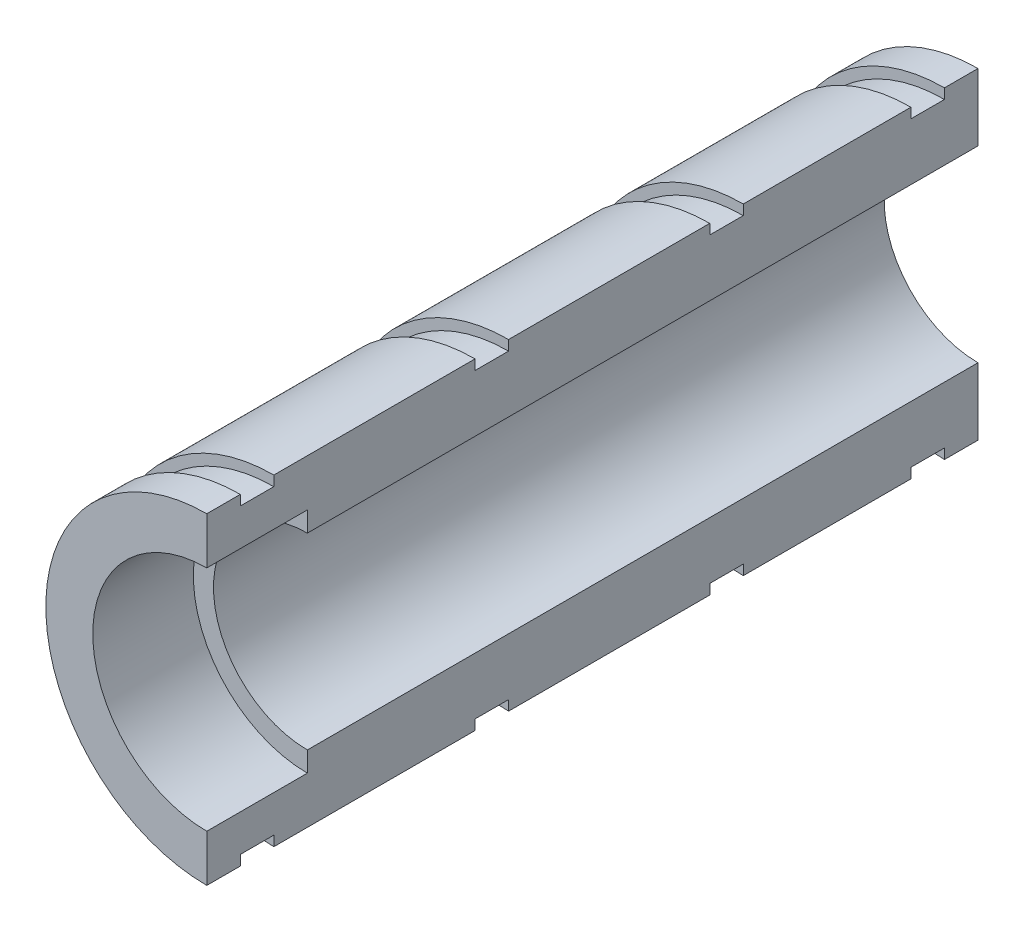
from build123d import *

# Parameters (mm, degrees)
SKETCH1_R           = 24
SKETCH1_R_2         = 14
BOSS_EXTRUDE1_DEPTH = 115
SKETCH2_W           = 30.560484556
SKETCH2_H           = 55.665733052
CUT_EXTRUDE1_DEPTH  = 130
SKETCH3_R           = 17
CUT_EXTRUDE2_DEPTH  = 15
SKETCH4_R           = 29.348690421
SKETCH4_R_2         = 22.5
CUT_EXTRUDE3_DEPTH  = 5
SKETCH5_R           = 32.227537674
SKETCH5_R_2         = 22.5
CUT_EXTRUDE4_DEPTH  = 5
SKETCH6_R           = 32.40953394
SKETCH6_R_2         = 22.5
CUT_EXTRUDE5_DEPTH  = 5
CUT_EXTRUDE6_START  = 5
SKETCH7_R           = 39.356381894
SKETCH7_R_2         = 22.5
CUT_EXTRUDE6_DEPTH  = 5


with BuildPart() as part:
    # Sketch1 → Boss-Extrude1 (new body)
    with BuildSketch(Plane.XY):
        Circle(SKETCH1_R)
        Circle(SKETCH1_R_2, mode=Mode.SUBTRACT)
    extrude(amount=BOSS_EXTRUDE1_DEPTH)

    # Sketch2 → Cut-Extrude1 (cut)
    with BuildSketch(Plane.XY.offset(115)):
        with Locations((15.280242278, -0.503267732)):
            Rectangle(SKETCH2_W, SKETCH2_H)
    extrude(amount=-CUT_EXTRUDE1_DEPTH, mode=Mode.SUBTRACT)

    # Sketch3 → Cut-Extrude2 (cut)
    with BuildSketch(Plane.XY.offset(115)):
        Circle(SKETCH3_R)
    extrude(amount=-CUT_EXTRUDE2_DEPTH, mode=Mode.SUBTRACT)

    # Sketch4 → Cut-Extrude3 (cut)
    with BuildSketch(Plane(origin=(0, 0, 35), x_dir=(-1, 0, 0), z_dir=(0, 0, -1))):
        Circle(SKETCH4_R)
        Circle(SKETCH4_R_2, mode=Mode.SUBTRACT)
    extrude(amount=-CUT_EXTRUDE3_DEPTH, mode=Mode.SUBTRACT)

    # Sketch5 → Cut-Extrude4 (cut)
    with BuildSketch(Plane(origin=(0, 0, 70), x_dir=(-1, 0, 0), z_dir=(0, 0, -1))):
        Circle(SKETCH5_R)
        Circle(SKETCH5_R_2, mode=Mode.SUBTRACT)
    extrude(amount=-CUT_EXTRUDE4_DEPTH, mode=Mode.SUBTRACT)

    # Sketch6 → Cut-Extrude5 (cut)
    with BuildSketch(Plane.XY.offset(105)):
        Circle(SKETCH6_R)
        Circle(SKETCH6_R_2, mode=Mode.SUBTRACT)
    extrude(amount=CUT_EXTRUDE5_DEPTH, mode=Mode.SUBTRACT)

    # Sketch7 → Cut-Extrude6 (cut)
    with BuildSketch(Plane(origin=(0, 0, 10), x_dir=(-1, 0, 0), z_dir=(0, 0, -1)).offset(CUT_EXTRUDE6_START)):
        Circle(SKETCH7_R)
        Circle(SKETCH7_R_2, mode=Mode.SUBTRACT)
    extrude(amount=-CUT_EXTRUDE6_DEPTH, mode=Mode.SUBTRACT)


solid = part.part
